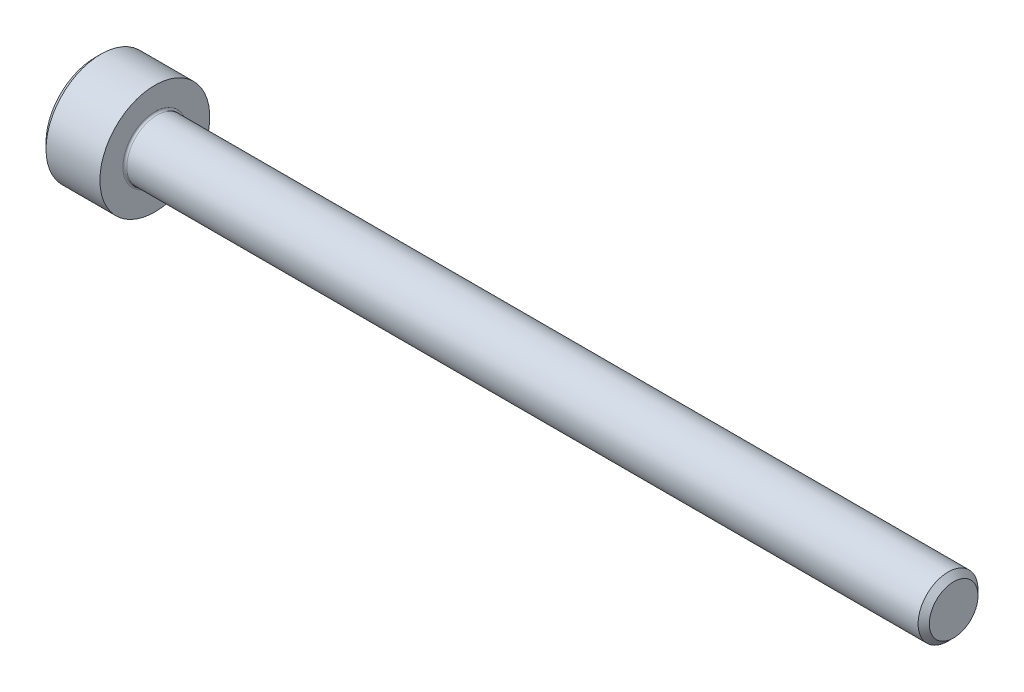
from build123d import *

# Parameters (mm, degrees)
FILLET1_R   = 0.1
HEX_2_DEPTH = 1.3


with BuildPart() as part:
    # BodySke → Base-Revolve (revolve)
    with BuildSketch(Plane.XY, mode=Mode.PRIVATE) as base_revolve_sk:
        Polygon((0, 0), (0, 2.45), (0.3, 2.75), (3, 2.75), (3, 1.5), (42.7195, 1.5), (43, 1.2195), (43, 0), align=None)
    revolve(base_revolve_sk.sketch.rotate(Axis((-31.75, 0, 0), (1, 0, 0)), 90), axis=Axis((-31.75, 0, 0), (1, 0, 0)))

    # Fillet1
    fillet1_edges = [part.edges().sort_by_distance(p)[0] for p in [
        (3, 0, -1.5),
    ]]
    fillet(fillet1_edges, radius=FILLET1_R)

    # Sketch2 → Hex-PreBroach (revolve, cut)
    with BuildSketch(Plane.XY, mode=Mode.PRIVATE) as hex_prebroach_sk:
        Polygon((0, 1.28), (1.3, 1.28), (2.039008345, 0), (0, 0), align=None)
    revolve(hex_prebroach_sk.sketch.rotate(Axis((0, 0, 0), (1, 0, 0)), 90), axis=Axis((0, 0, 0), (1, 0, 0)), mode=Mode.SUBTRACT)

    # Sketch3 → Hex 2 (cut)
    with BuildSketch(Plane(origin=(0, 0, 0), x_dir=(0, 0.500000000000001, 0.866025403784438), z_dir=(-1, 0, 0))):
        Polygon((0.739008345, 1.28), (-0.739008345, 1.28), (-1.478016689, 0), (-0.739008345, -1.28), (0.739008345, -1.28), (1.478016689, 0), align=None)
    extrude(amount=-HEX_2_DEPTH, mode=Mode.SUBTRACT)


solid = part.part
